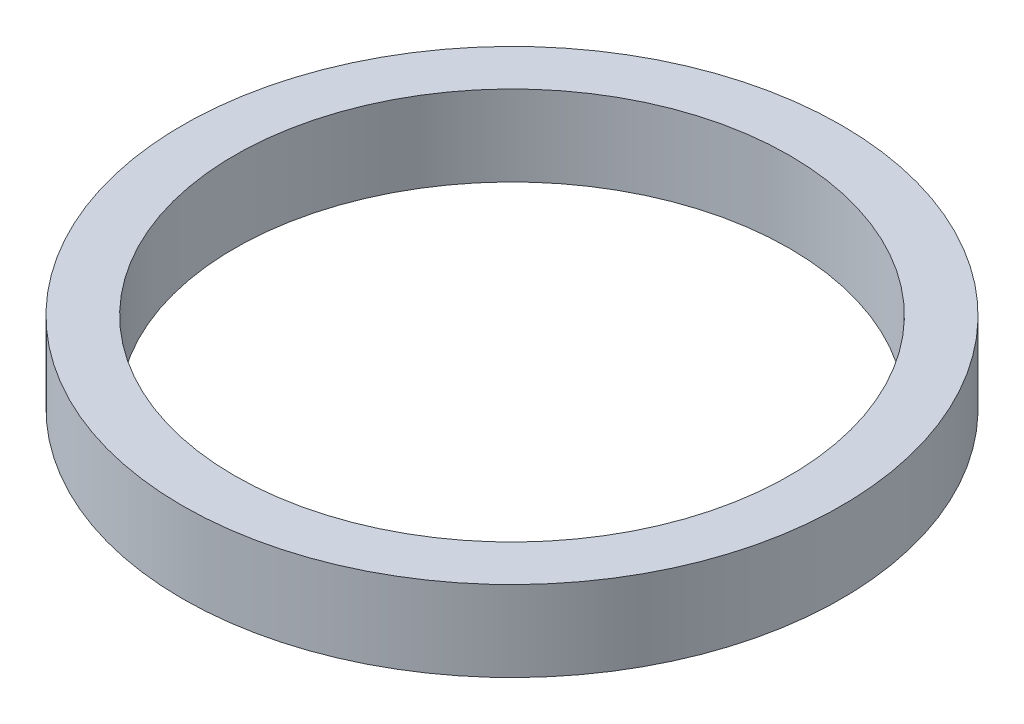
from build123d import *

# Parameters (mm, degrees)
ESQUISSE1_R        = 20.46
ESQUISSE1_R_2      = 17.225
BOSS_EXTRU_1_DEPTH = 5


with BuildPart() as part:
    # Esquisse1 → Boss.-Extru.1 (new body)
    with BuildSketch(Plane(origin=(0, 0, 0), x_dir=(1, 0, 0), z_dir=(0, 1, 0))):
        with Locations(Location((0, 0, 0), (0, 0, 270))):
            Circle(ESQUISSE1_R)
        with Locations(Location((0, 0, 0), (0, 0, 270))):
            Circle(ESQUISSE1_R_2, mode=Mode.SUBTRACT)
    extrude(amount=BOSS_EXTRU_1_DEPTH)


solid = part.part
